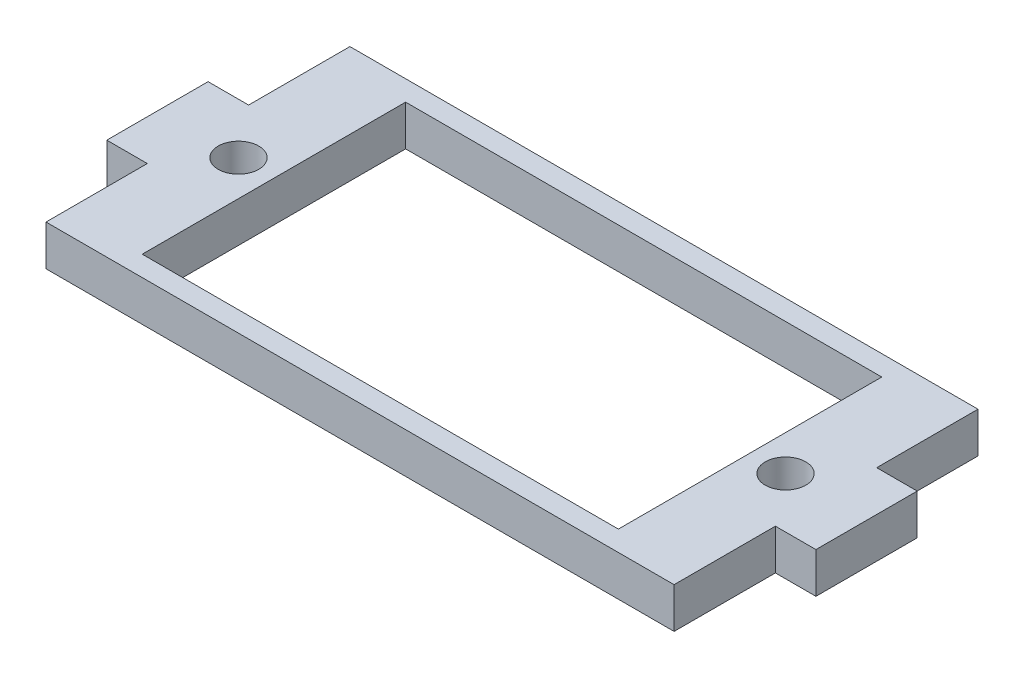
from build123d import *

# Parameters (mm, degrees)
SKETCH1_W           = 35
SKETCH1_H           = 15
SKETCH1_R           = 1
SKETCH1_W_2         = 23.5
SKETCH1_H_2         = 13
BOSS_EXTRUDE1_DEPTH = 2
SKETCH2_W           = 2
SKETCH2_H           = 5
CUT_EXTRUDE1_DEPTH  = 2


with BuildPart() as part:
    # Sketch1 → Boss-Extrude1 (new body)
    with BuildSketch(Plane(origin=(0, 0, 0), x_dir=(1, 0, 0), z_dir=(0, 1, 0))):
        Rectangle(SKETCH1_W, SKETCH1_H)
        with Locations(Location((-13.5, 0, 0), (0, 0, 270))):
            Circle(SKETCH1_R, mode=Mode.SUBTRACT)
        with Locations(Location((13.5, 0, 0), (0, 0, 90))):
            Circle(SKETCH1_R, mode=Mode.SUBTRACT)
        Rectangle(SKETCH1_W_2, SKETCH1_H_2, mode=Mode.SUBTRACT)
    extrude(amount=BOSS_EXTRUDE1_DEPTH)

    # Sketch2 → Cut-Extrude1 (cut)
    with BuildSketch(Plane(origin=(0, 2, 0), x_dir=(1, 0, 0), z_dir=(0, 1, 0))):
        with Locations((16.5, 5)):
            Rectangle(SKETCH2_W, SKETCH2_H)
        with Locations((16.5, -5)):
            Rectangle(SKETCH2_W, SKETCH2_H)
        with Locations((-16.5, -5)):
            Rectangle(SKETCH2_W, SKETCH2_H)
        with Locations((-16.5, 5)):
            Rectangle(SKETCH2_W, SKETCH2_H)
    extrude(amount=-CUT_EXTRUDE1_DEPTH, mode=Mode.SUBTRACT)


solid = part.part
